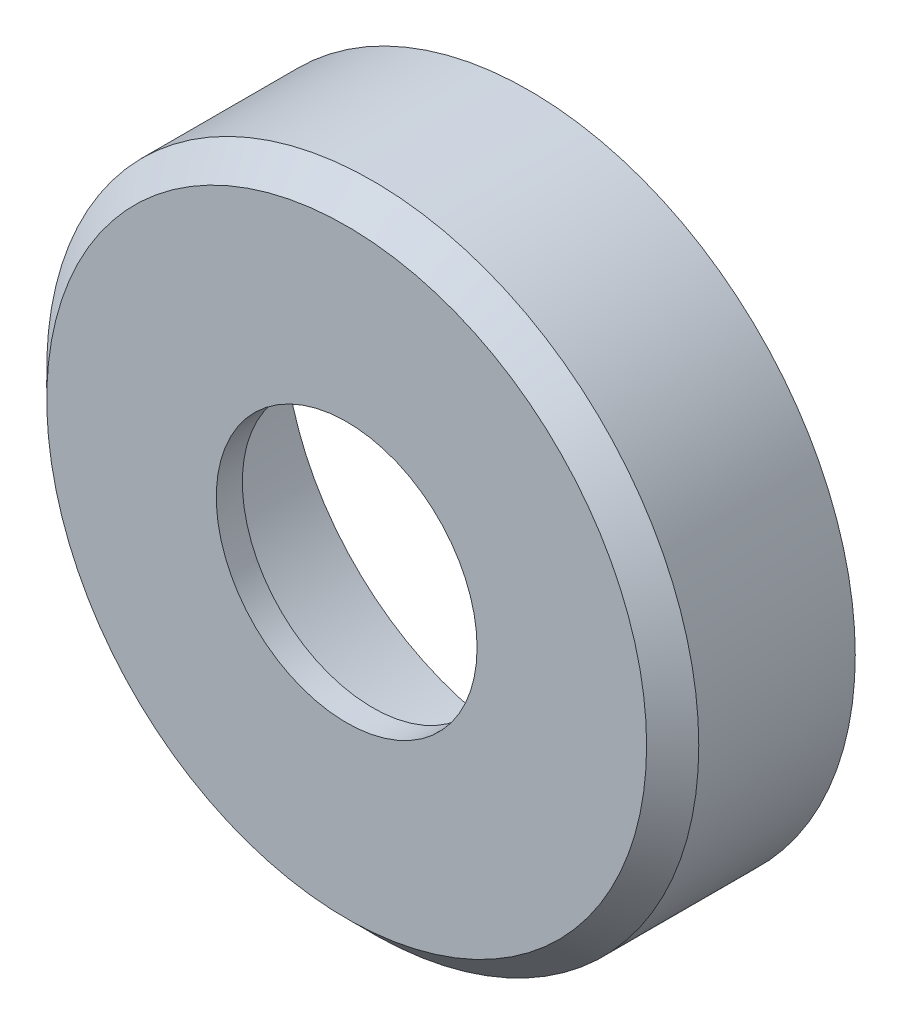
from build123d import *

# Parameters (mm, degrees)
SKETCH_1_R      = 12.5
SKETCH_1_R_2    = 9.4
EXTRUDE_1_DEPTH = 6
SKETCH_2_R      = 12.5
SKETCH_2_R_2    = 5
EXTRUDE_2_DEPTH = 1
CHAMFER_1_SIZE  = 1


with BuildPart() as part:
    # 草图1 → 凸台-拉伸1 (new body)
    with BuildSketch(Plane.XY):
        Circle(SKETCH_1_R)
        Circle(SKETCH_1_R_2, mode=Mode.SUBTRACT)
    extrude(amount=EXTRUDE_1_DEPTH)

    # 草图2 → 凸台-拉伸2 (add)
    with BuildSketch(Plane.XY.offset(6)):
        Circle(SKETCH_2_R)
        Circle(SKETCH_2_R_2, mode=Mode.SUBTRACT)
    extrude(amount=EXTRUDE_2_DEPTH)

    # 倒角1
    chamfer_1_edges = [part.edges().sort_by_distance(p)[0] for p in [
        (-12.5, 0, 7),
    ]]
    chamfer(chamfer_1_edges, length=CHAMFER_1_SIZE)


solid = part.part
